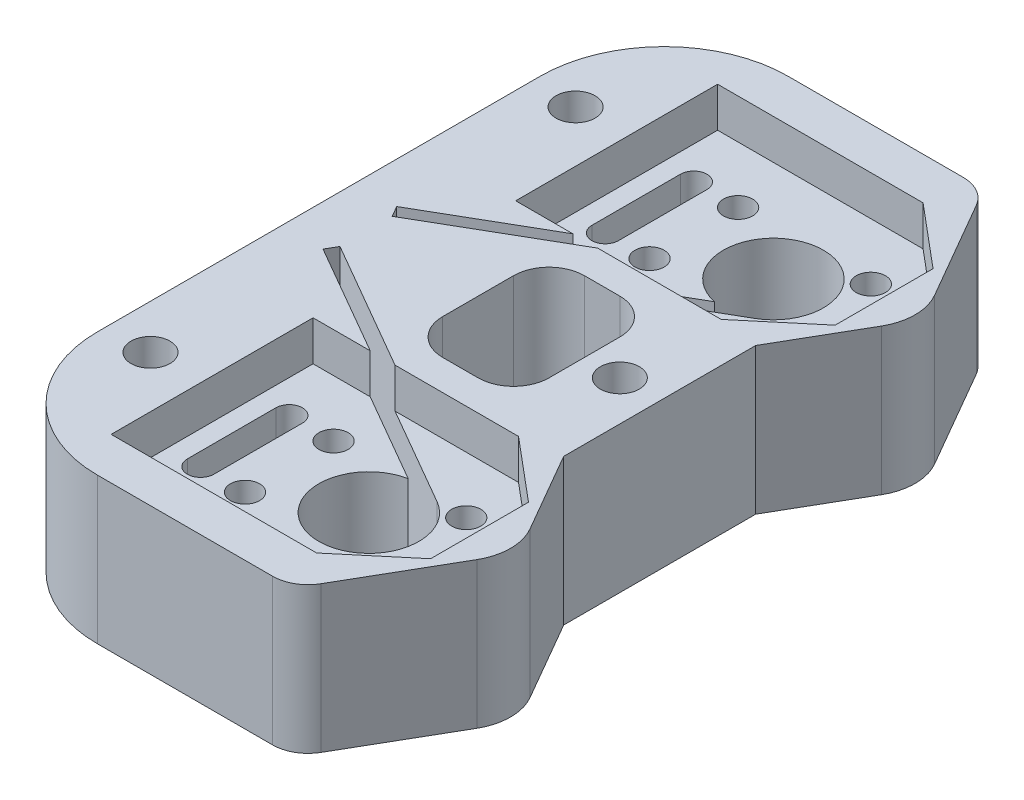
from build123d import *
from build123d.topology import SkipClean

# Parameters (mm, degrees)
SKETCH1_W                  = 22
SKETCH1_H                  = 39
SKETCH1_W_2                = 6
SKETCH1_H_2                = 8
BOSS_EXTRUDE1_DEPTH        = 8.25
CUT_EXTRUDE3_DEPTH         = 2.25
SKETCH7_R                  = 2.825
SKETCH7_R_2                = 0.825
CUT_EXTRUDE4_DEPTH         = 1.25
SKETCH9_R                  = 0.75
CUT_EXTRUDE5_DEPTH         = 39.274404999
CUT_EXTRUDE1_DEPTH         = 39.690988331
CUT_EXTRUDE1_DEPTH_BACK    = 39.690988331
SKETCH6_R                  = 2.825
BOSS_EXTRUDE2_DEPTH        = 8.25
FILLET4_R                  = 2
CUT_EXTRUDE7_DEPTH         = 39.900472274
FILLET5_R                  = 7
F_2_2_2_2_DIAMETER_HOLE1_D = 2.2
FILLET6_R                  = 2


with BuildPart() as part:
    # Sketch1 → Boss-Extrude1 (new body)
    with BuildSketch(Plane(origin=(0, 0, 0), x_dir=(1, 0, 0), z_dir=(0, 1, 0))):
        with Locations((21.383330249, 0)):
            Rectangle(SKETCH1_W, SKETCH1_H)
        with Locations((22.383330249, 0)):
            Rectangle(SKETCH1_W_2, SKETCH1_H_2, mode=Mode.SUBTRACT)
    extrude(amount=BOSS_EXTRUDE1_DEPTH)

    # Sketch8 → Cut-Extrude3 (cut)
    with BuildSketch(Plane(origin=(0, 8.25, 0), x_dir=(1, 0, 0), z_dir=(0, 1, 0))):
        Polygon((15.783330249, 17.120672783), (27.383330249, 17.120672783), (30.883330249, 14.183824074), (30.883330249, 8.657521492), (27.383330249, 5.720672783), (15.783330249, 5.720672783), align=None)
        Polygon((27.383330249, -17.120672783), (30.883330249, -14.183824074), (30.883330249, -8.657521492), (27.383330249, -5.720672783), (15.783330249, -5.720672783), (15.783330249, -17.120672783), align=None)
    extrude(amount=-CUT_EXTRUDE3_DEPTH, mode=Mode.SUBTRACT)

    # Sketch7 → Cut-Extrude4 (cut)
    with BuildSketch(Plane(origin=(0, 6, 0), x_dir=(1, 0, 0), z_dir=(0, 1, 0))):
        with Locations(Location((24.633330249, 11.420672783, 0), (0, 0, 270))):
            Circle(SKETCH7_R)
        with Locations(Location((20.140330249, 13.920672783, 0), (0, 0, 270))):
            Circle(SKETCH7_R_2)
        with Locations(Location((27.633330249, 13.920672783, 0), (0, 0, 270))):
            Circle(SKETCH7_R_2)
        with Locations(Location((27.633330249, 8.920672783, 0), (0, 0, 270))):
            Circle(SKETCH7_R_2)
        with Locations(Location((20.140330249, 8.920672783, 0), (0, 0, 270))):
            Circle(SKETCH7_R_2)
        with Locations(Location((20.140330249, -8.920672783, 0), (0, 0, 90))):
            Circle(SKETCH7_R_2)
        with Locations(Location((27.633330249, -8.920672783, 0), (0, 0, 90))):
            Circle(SKETCH7_R_2)
        with Locations(Location((27.633330249, -13.920672783, 0), (0, 0, 90))):
            Circle(SKETCH7_R_2)
        with Locations(Location((20.140330249, -13.920672783, 0), (0, 0, 90))):
            Circle(SKETCH7_R_2)
        with Locations(Location((24.633330249, -11.420672783, 0), (0, 0, 90))):
            Circle(SKETCH7_R)
    extrude(amount=-CUT_EXTRUDE4_DEPTH, mode=Mode.SUBTRACT)

    # Sketch9 → Cut-Extrude5 (cut, through all)
    with BuildSketch(Plane(origin=(0, 6, 0), x_dir=(1, 0, 0), z_dir=(0, 1, 0))):
        with Locations(Location((30.133330249, 11.420672783, 0), (0, 0, 270))):
            Circle(SKETCH9_R)
        with Locations((30.133330249, -11.420672783)):
            Circle(SKETCH9_R)
        with BuildLine():
            Line((16.883330249, 8.920672783), (16.883330249, 13.920672783))
            ThreePointArc((16.883330249, 13.920672783), (17.633330249, 14.670672783), (18.383330249, 13.920672783))
            Line((18.383330249, 13.920672783), (18.383330249, 8.920672783))
            ThreePointArc((18.383330249, 8.920672783), (17.633330249, 8.170672783), (16.883330249, 8.920672783))
        make_face()
        with BuildLine():
            Line((16.883330249, -8.920672783), (16.883330249, -13.920672783))
            ThreePointArc((16.883330249, -13.920672783), (17.633330249, -14.670672783), (18.383330249, -13.920672783))
            Line((18.383330249, -13.920672783), (18.383330249, -8.920672783))
            ThreePointArc((18.383330249, -8.920672783), (17.633330249, -8.170672783), (16.883330249, -8.920672783))
        make_face()
    extrude(amount=-CUT_EXTRUDE5_DEPTH, mode=Mode.SUBTRACT)

    # Sketch6 → Cut-Extrude1 (cut, two sides: drawn at the far end of the back side and taken through both)
    with BuildSketch(Plane(origin=(0, 8.25, 0), x_dir=(-1, 0, 0), z_dir=(0, -1, 0)).offset(-CUT_EXTRUDE1_DEPTH_BACK)):
        with Locations((-24.633330249, -11.420672783)):
            Circle(SKETCH6_R)
        with Locations((-24.633330249, 11.420672783)):
            Circle(SKETCH6_R)
        Polygon((-26.045830249, -8.974151017), (-25.695830249, -9.5803688), (-12.705449192, -2.0803688), (-13.055449192, -1.474151017), align=None)
        Polygon((-13.055449192, 1.474151017), (-12.705449192, 2.0803688), (-25.695830249, 9.5803688), (-26.045830249, 8.974151017), align=None)
    extrude(amount=CUT_EXTRUDE1_DEPTH + CUT_EXTRUDE1_DEPTH_BACK, mode=Mode.SUBTRACT)

    # Sketch11 → Boss-Extrude2 (add, through all)
    with BuildSketch(Plane(origin=(0, 8.25, 0), x_dir=(1, 0, 0), z_dir=(0, 1, 0))):
        with BuildLine():
            ThreePointArc((32.383330249, 10.221714902), (32.633330249, 11.420672783), (32.383330249, 12.619630664))
            Line((32.383330249, 12.619630664), (32.383330249, 10.221714902))
        make_face()
        with BuildLine():
            ThreePointArc((32.383330249, -12.619630664), (32.633330249, -11.420672783), (32.383330249, -10.221714902))
            Line((32.383330249, -10.221714902), (32.383330249, -12.619630664))
        make_face()
    extrude(amount=-BOSS_EXTRUDE2_DEPTH)

    # Fillet4
    fillet4_edges = [part.edges().sort_by_distance(p)[0] for p in [
        (25.383330249, 4.125, -4),
        (19.383330249, 4.125, -4),
        (19.383330249, 4.125, 4),
        (25.383330249, 4.125, 4),
    ]]
    fillet(fillet4_edges, radius=FILLET4_R)

    # Sketch11<4> → Cut-Extrude7 (cut, through all)
    with SkipClean():  # the faces are left unmerged after this step: merging them gives an invalid solid
        with BuildSketch(Plane(origin=(0, 8.25, 0), x_dir=(1, 0, 0), z_dir=(0, 1, 0))):
            with BuildLine():
                Line((29.633330249, 17.420672783), (32.231406461, 12.920672783))
                ThreePointArc((32.231406461, 12.920672783), (32.311601404, 12.772287972), (32.383330249, 12.619630664))
                Line((32.383330249, 12.619630664), (32.383330249, 19.5))
                Line((32.383330249, 19.5), (28.432830121, 19.5))
                Line((28.432830121, 19.5), (29.633330249, 17.420672783))
            make_face()
            with BuildLine():
                Line((32.383330249, -10.221714902), (32.383330249, 10.221714902))
                ThreePointArc((32.383330249, 10.221714902), (32.311601404, 10.069057593), (32.231406461, 9.920672783))
                Line((32.231406461, 9.920672783), (29.633330249, 5.420672783))
                Line((29.633330249, 5.420672783), (29.633330249, -5.420672783))
                Line((29.633330249, -5.420672783), (32.231406461, -9.920672783))
                ThreePointArc((32.231406461, -9.920672783), (32.311601404, -10.069057593), (32.383330249, -10.221714902))
            make_face()
            with BuildLine():
                Line((32.383330249, -19.5), (32.383330249, -12.619630664))
                ThreePointArc((32.383330249, -12.619630664), (32.311601404, -12.772287972), (32.231406461, -12.920672783))
                Line((32.231406461, -12.920672783), (29.633330249, -17.420672783))
                Line((29.633330249, -17.420672783), (28.432830121, -19.5))
                Line((28.432830121, -19.5), (32.383330249, -19.5))
            make_face()
        extrude(amount=-CUT_EXTRUDE7_DEPTH, mode=Mode.SUBTRACT)

    # Fillet5
    fillet5_edges = [part.edges().sort_by_distance(p)[0] for p in [
        (10.383330249, 4.125, 19.5),
        (10.383330249, 4.125, -19.5),
    ]]
    fillet(fillet5_edges, radius=FILLET5_R)

    # Ø2.2 (2.2) Diameter Hole1 (through all)
    with Locations(Plane(origin=(12.883330249, 8.25, -12), x_dir=(0, 0, 1), z_dir=(0, 1, 0))):
        with Locations((0, 0), (12, 14.5), (24, 0)):
            Hole(F_2_2_2_2_DIAMETER_HOLE1_D / 2)

    # Fillet6
    fillet6_edges = [part.edges().sort_by_distance(p)[0] for p in [
        (28.432830121, 4.125, -19.5),
        (28.432830121, 4.125, 19.5),
    ]]
    fillet(fillet6_edges, radius=FILLET6_R)


solid = part.part
